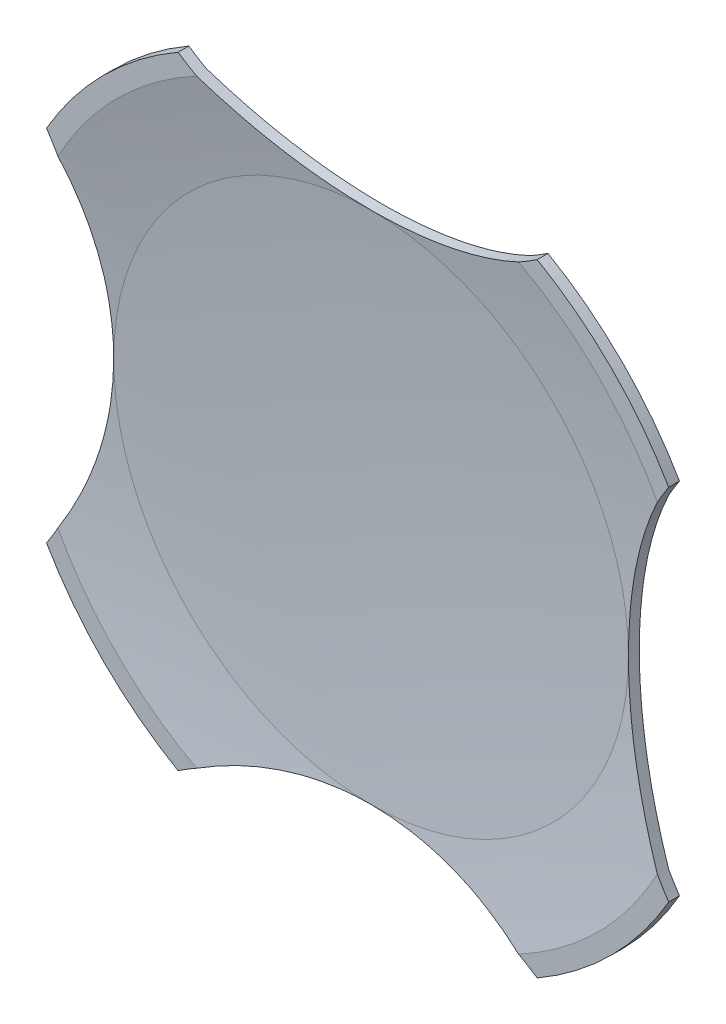
from build123d import *

# Parameters (mm, degrees)
CUT_EXTRUDE_1_DEPTH = 10


with BuildPart() as part:
    # 草图1 → 旋转5 (revolve)
    with BuildSketch(Plane(origin=(0, 0, 0), x_dir=(1, 0, 0), z_dir=(0, 1, 0))):
        with BuildLine():
            Line((4.75, 37.642530217), (5, 37.642530217))
            Line((5, 37.642530217), (5, 37.492530217))
            Line((5, 37.492530217), (4.736204208, 37.492530217))
            ThreePointArc((4.736204208, 37.492530217), (4.160424845, 37.592803525), (3.58253169, 37.680073868))
            ThreePointArc((3.58253169, 37.680073868), (1.793279691, 37.8074946), (0, 37.85))
            Line((0, 37.85), (0, 38))
            ThreePointArc((0, 38), (1.802027362, 37.957248285), (3.6, 37.829089336))
            ThreePointArc((3.6, 37.829089336), (4.176041915, 37.742232418), (4.75, 37.642530217))
        make_face()
    revolve(axis=Axis((0, 0, -22.128426055), (0, 0, 1)))

    # 草图2 → 切除-拉伸1 (cut)
    with BuildSketch(Plane.XY.offset(-37.492530217)):
        with BuildLine():
            ThreePointArc((4.330127019, -2.5), (5, 0), (4.330127019, 2.5))
            ThreePointArc((4.330127019, 2.5), (3.58253169, 0), (4.330127019, -2.5))
        make_face()
        with BuildLine():
            ThreePointArc((2.5, 4.330127019), (0, 5), (-2.5, 4.330127019))
            ThreePointArc((-2.5, 4.330127019), (0, 3.58253169), (2.5, 4.330127019))
        make_face()
        with BuildLine():
            ThreePointArc((-2.5, -4.330127019), (0, -5), (2.5, -4.330127019))
            ThreePointArc((2.5, -4.330127019), (0, -3.58253169), (-2.5, -4.330127019))
        make_face()
        with BuildLine():
            ThreePointArc((-4.330127019, 2.5), (-5, 0), (-4.330127019, -2.5))
            ThreePointArc((-4.330127019, -2.5), (-3.58253169, 0), (-4.330127019, 2.5))
        make_face()
    extrude(amount=-CUT_EXTRUDE_1_DEPTH, mode=Mode.SUBTRACT)


solid = part.part
